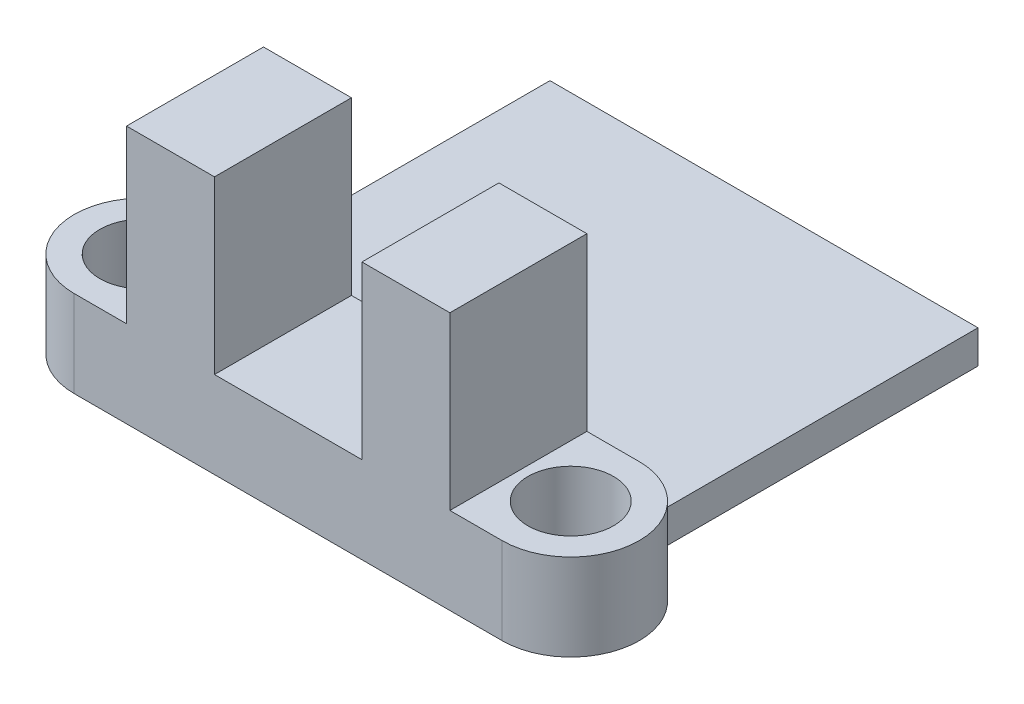
from build123d import *

# Parameters (mm, degrees)
BOSS_EXTRUDE1_DEPTH = 1.55
BOSS_EXTRUDE2_DEPTH = 2.5
SKETCH4_W           = 4.11
SKETCH4_H           = 6.4
BOSS_EXTRUDE3_DEPTH = 8
SKETCH6_R           = 2
CUT_EXTRUDE1_DEPTH  = 20.020600017


with BuildPart() as part:
    # Sketch1 → Boss-Extrude1 (new body)
    with BuildSketch(Plane(origin=(0, 0, 0), x_dir=(1, 0, 0), z_dir=(0, 1, 0))):
        with BuildLine():
            Line((10, -4.715), (10, 11.115))
            Line((10, 11.115), (-10, 11.115))
            Line((-10, 11.115), (-10, -4.715))
            ThreePointArc((-10, -4.715), (-13.2, -7.915), (-10, -11.115))
            Line((-10, -11.115), (10, -11.115))
            ThreePointArc((10, -11.115), (13.2, -7.915), (10, -4.715))
        make_face()
    extrude(amount=BOSS_EXTRUDE1_DEPTH)

    # Sketch3 → Boss-Extrude2 (add)
    with BuildSketch(Plane(origin=(0, 1.55, 0), x_dir=(1, 0, 0), z_dir=(0, 1, 0))):
        with BuildLine():
            Line((-10, -4.715), (10, -4.715))
            ThreePointArc((10, -4.715), (13.2, -7.915), (10, -11.115))
            Line((10, -11.115), (-10, -11.115))
            ThreePointArc((-10, -11.115), (-13.2, -7.915), (-10, -4.715))
        make_face()
    extrude(amount=BOSS_EXTRUDE2_DEPTH)

    # Sketch4 → Boss-Extrude3 (add)
    with BuildSketch(Plane(origin=(0, 4.05, 0), x_dir=(1, 0, 0), z_dir=(0, 1, 0))):
        with Locations((-5.5, -7.915)):
            Rectangle(SKETCH4_W, SKETCH4_H)
        with Locations((5.5, -7.915)):
            Rectangle(SKETCH4_W, SKETCH4_H)
    extrude(amount=BOSS_EXTRUDE3_DEPTH)

    # Sketch6 → Cut-Extrude1 (cut, through all)
    with BuildSketch(Plane(origin=(0, 4.05, 0), x_dir=(1, 0, 0), z_dir=(0, 1, 0))):
        with Locations(Location((-10, -7.915, 0), (0, 0, 270))):
            Circle(SKETCH6_R)
        with Locations(Location((10, -7.915, 0), (0, 0, 270))):
            Circle(SKETCH6_R)
    extrude(amount=-CUT_EXTRUDE1_DEPTH, mode=Mode.SUBTRACT)


solid = part.part
